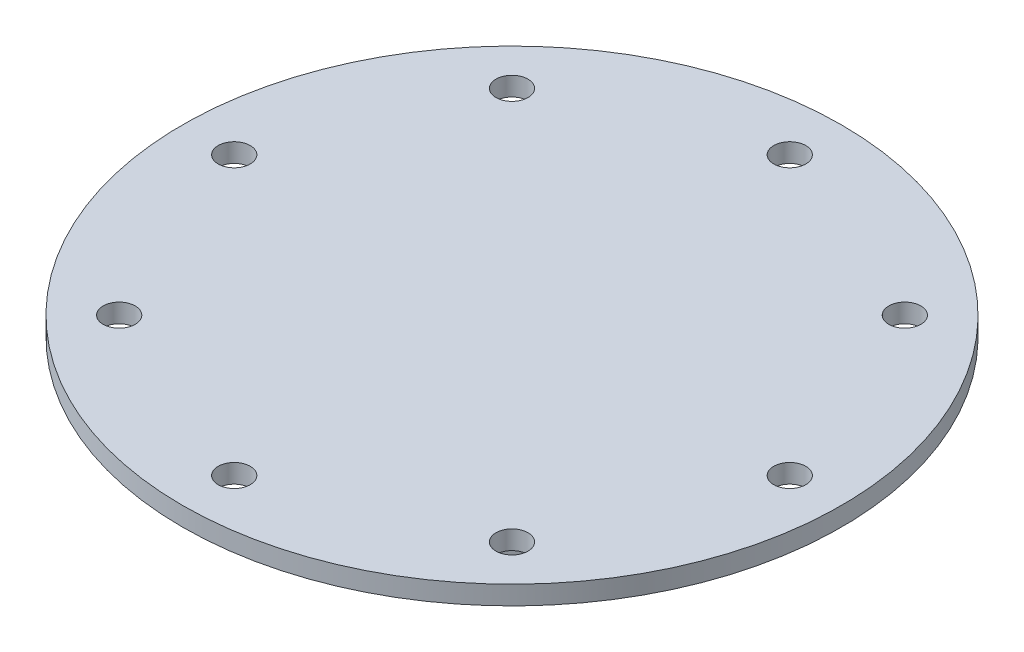
from build123d import *

# Parameters (mm, degrees)
SKETCH_1_R      = 70
SKETCH_1_R_2    = 3.4
EXTRUDE_1_DEPTH = 4
SKETCH_2_R      = 40
SKETCH_2_R_2    = 35
EXTRUDE_2_DEPTH = 21
FILLET_2_R      = 1


with BuildPart() as part:
    # Эскиз1 → Бобышка-Вытянуть1 (new body)
    with BuildSketch(Plane(origin=(0, 0, 0), x_dir=(1, 0, 0), z_dir=(0, 1, 0))):
        with Locations(Location((0, 0, 0), (0, 0, 270))):
            Circle(SKETCH_1_R)
        with Locations(Location((59, 0, 0), (0, 0, 270))):
            Circle(SKETCH_1_R_2, mode=Mode.SUBTRACT)
        with Locations(Location((41.71930009, -41.71930009, 0), (0, 0, 270))):
            Circle(SKETCH_1_R_2, mode=Mode.SUBTRACT)
        with Locations(Location((0, -59, 0), (0, 0, 270))):
            Circle(SKETCH_1_R_2, mode=Mode.SUBTRACT)
        with Locations(Location((-41.71930009, -41.71930009, 0), (0, 0, 270))):
            Circle(SKETCH_1_R_2, mode=Mode.SUBTRACT)
        with Locations(Location((-59, 0, 0), (0, 0, 270))):
            Circle(SKETCH_1_R_2, mode=Mode.SUBTRACT)
        with Locations(Location((-41.71930009, 41.71930009, 0), (0, 0, 270))):
            Circle(SKETCH_1_R_2, mode=Mode.SUBTRACT)
        with Locations(Location((0, 59, 0), (0, 0, 270))):
            Circle(SKETCH_1_R_2, mode=Mode.SUBTRACT)
        with Locations(Location((41.71930009, 41.71930009, 0), (0, 0, 270))):
            Circle(SKETCH_1_R_2, mode=Mode.SUBTRACT)
    extrude(amount=EXTRUDE_1_DEPTH)

    # Эскиз2 → Бобышка-Вытянуть2 (add)
    with BuildSketch(Plane(origin=(0, 0, 0), x_dir=(1, 0, 0), z_dir=(0, 1, 0))):
        with Locations(Location((0, 0, 0), (0, 0, 270))):
            Circle(SKETCH_2_R)
        with Locations(Location((0, 0, 0), (0, 0, 270))):
            Circle(SKETCH_2_R_2, mode=Mode.SUBTRACT)
    extrude(amount=-EXTRUDE_2_DEPTH)

    # Скругление2
    fillet_2_edges = [part.edges().sort_by_distance(p)[0] for p in [
        (0, 0, -35),
        (0, 0, -40),
    ]]
    fillet(fillet_2_edges, radius=FILLET_2_R)


solid = part.part
